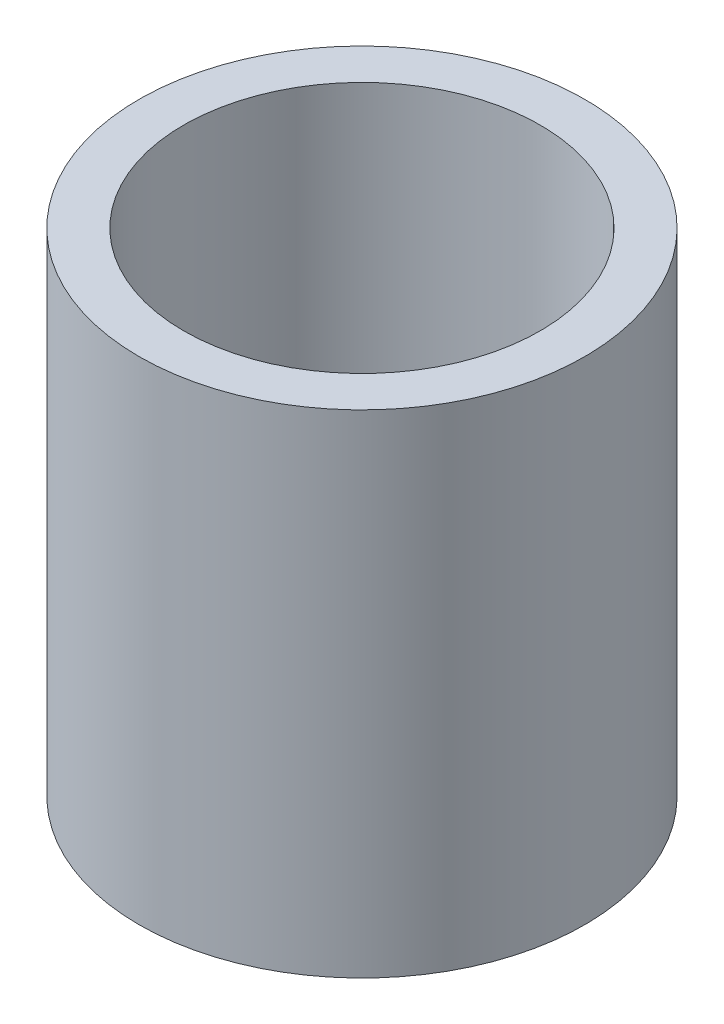
from build123d import *

# Parameters (mm, degrees)
SKETCH2_R           = 0.625
SKETCH2_R_2         = 0.5
BOSS_EXTRUDE1_DEPTH = 0.69


with BuildPart() as part:
    # Sketch2 → Boss-Extrude1 (new, symmetric)
    with BuildSketch(Plane(origin=(0, 0, 0), x_dir=(1, 0, 0), z_dir=(0, 1, 0))):
        with Locations(Location((0, 0, 0), (0, 0, 270))):
            Circle(SKETCH2_R)
        with Locations(Location((0, 0, 0), (0, 0, 270))):
            Circle(SKETCH2_R_2, mode=Mode.SUBTRACT)
    extrude(amount=BOSS_EXTRUDE1_DEPTH, both=True)


solid = part.part
